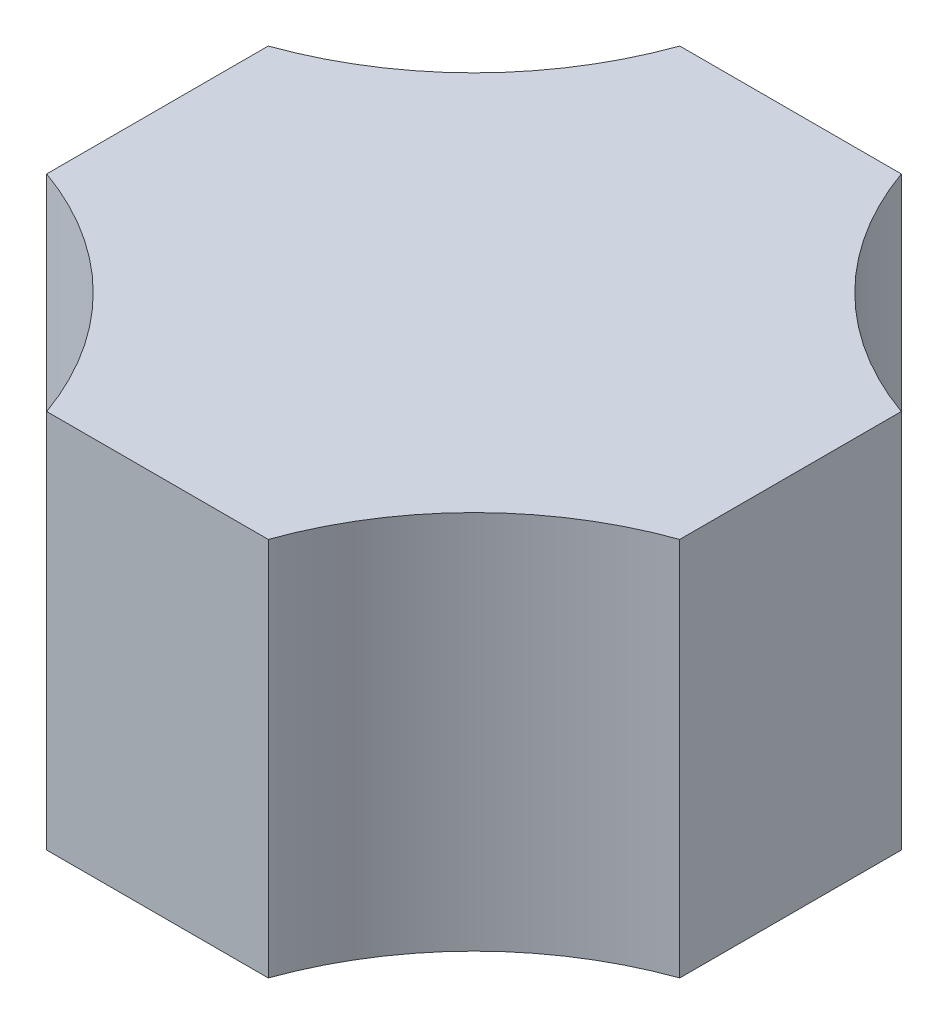
from build123d import *

# Parameters (mm, degrees)
BOSS_EXTRUDE6_DEPTH = 15.24


with BuildPart() as part:
    # Sketch2 → Boss-Extrude6 (new body)
    with BuildSketch(Plane(origin=(0, 0, 0), x_dir=(1, 0, 0), z_dir=(0, 1, 0))):
        with BuildLine():
            Line((8.255, 25.4), (17.145, 25.4))
            ThreePointArc((17.145, 25.4), (20.339245744, 20.339245744), (25.4, 17.145))
            Line((25.4, 17.145), (25.4, 8.255))
            ThreePointArc((25.4, 8.255), (20.339245744, 5.060754256), (17.145, 0))
            Line((17.145, 0), (8.255, 0))
            ThreePointArc((8.255, 0), (5.060754256, 5.060754256), (0, 8.255))
            Line((0, 8.255), (0, 17.145))
            ThreePointArc((0, 17.145), (5.060754256, 20.339245744), (8.255, 25.4))
        make_face()
    extrude(amount=-BOSS_EXTRUDE6_DEPTH)


solid = part.part
